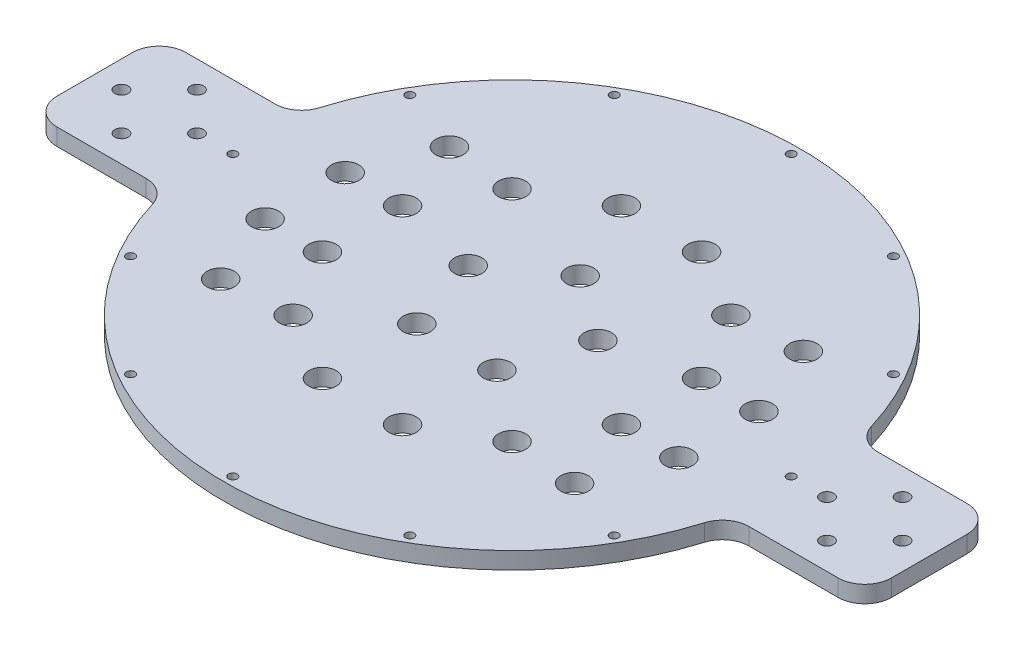
from build123d import *

# Parameters (mm, degrees)
SKETCH1_R              = 107.95
BOSS_EXTRUDE1_DEPTH    = 6.35
M3_CLEARANCE_HOLE1_D   = 3.2
CIRPATTERN1_COUNT      = 12
BOSS_EXTRUDE2_DEPTH    = 6.35
FILLET1_R              = 10
FILLET1_OF_MIRROR1_R   = 10
F_10_CLEARANCE_HOLE3_D = 4.9784
SKETCH11_R             = 5.1
CUT_EXTRUDE1_DEPTH     = 6.35


with BuildPart() as part:
    # Sketch1 → Boss-Extrude1 (new body)
    with BuildSketch(Plane(origin=(0, 0, 0), x_dir=(1, 0, 0), z_dir=(0, 1, 0))):
        with Locations(Location((0, 0, 0), (0, 0, 270))):
            Circle(SKETCH1_R)
    extrude(amount=BOSS_EXTRUDE1_DEPTH)

    # M3 Clearance Hole1 (through all)
    with Locations(Plane(origin=(0, 6.35, 0), x_dir=(1, 0, 0), z_dir=(0, 1, 0))):
        with Locations((0, 104.55)):
            m3_clearance_hole1 = Hole(M3_CLEARANCE_HOLE1_D / 2)

    # CirPattern1: M3 Clearance Hole1 ×12 about axis
    cirpattern1_axis = Axis((0, 0, 0), (0, 1, 0))
    for i in range(1, CIRPATTERN1_COUNT):
        add(m3_clearance_hole1.rotate(cirpattern1_axis, i * 360 / CIRPATTERN1_COUNT), mode=Mode.SUBTRACT)

    # Sketch2 → Boss-Extrude2 (add)
    with BuildSketch(Plane(origin=(0, 0, 0), x_dir=(1, 0, 0), z_dir=(0, 1, 0))):
        with BuildLine():
            Line((-156.234271247, 24.142135624), (-105.215777275, 24.142135624))
            ThreePointArc((-105.215777275, 24.142135624), (-107.95, 0), (-105.215777275, -24.142135624))
            Line((-105.215777275, -24.142135624), (-156.234271247, -24.142135624))
            Line((-156.234271247, -24.142135624), (-156.234271247, 24.142135624))
        make_face()
    boss_extrude2 = extrude(amount=BOSS_EXTRUDE2_DEPTH)

    # Fillet1
    fillet1_edges = [part.edges().sort_by_distance(p)[0] for p in [
        (-156.234271247, 3.175, -24.142135624),
        (-156.234271247, 3.175, 24.142135624),
        (-105.215777275, 3.175, 24.142135624),
        (-105.215777275, 3.175, -24.142135624),
    ]]
    fillet(fillet1_edges, radius=FILLET1_R)

    # Mirror1: Boss-Extrude2 across plane
    add(boss_extrude2.mirror(Plane(origin=(0, 0, 0), x_dir=(0, 0, 1), z_dir=(1, 0, 0))))

    # Fillet1 of Mirror1
    fillet1_of_mirror1_edges = [part.edges().sort_by_distance(p)[0] for p in [
        (156.234271247, 3.175, -24.142135624),
        (156.234271247, 3.175, 24.142135624),
        (105.215777275, 3.175, 24.142135624),
        (105.215777275, 3.175, -24.142135624),
    ]]
    fillet(fillet1_of_mirror1_edges, radius=FILLET1_OF_MIRROR1_R)

    # #10 Clearance Hole3 (through all)
    with Locations(Plane(origin=(0, 6.35, 0), x_dir=(1, 0, 0), z_dir=(0, 1, 0))):
        with Locations((-132.092135624, -14.142135624), (-117.95, 0), (-132.092135624, 14.142135624), (-146.234271247, 0), (146.234271247, 0), (132.092135624, 14.142135624), (117.95, 0), (132.092135624, -14.142135624)):
            Hole(F_10_CLEARANCE_HOLE3_D / 2)

    # Sketch11 → Cut-Extrude1 (cut)
    with BuildSketch(Plane(origin=(0, 6.35, 0), x_dir=(1, 0, 0), z_dir=(0, 1, 0))):
        with Locations(Location((-66.262216278, 42.831398459, 0), (0, 0, 270))):
            Circle(SKETCH11_R)
        with Locations(Location((-77.461022456, 15, 0), (0, 0, 270))):
            Circle(SKETCH11_R)
        with Locations(Location((-77.461022456, -15, 0), (0, 0, 270))):
            Circle(SKETCH11_R)
        with Locations(Location((-66.262216278, -42.831398459, 0), (0, 0, 270))):
            Circle(SKETCH11_R)
        with Locations(Location((0, 25.519524251, 0), (0, 0, 270))):
            Circle(SKETCH11_R)
        with Locations(Location((-24.270509831, 7.885966682, 0), (0, 0, 270))):
            Circle(SKETCH11_R)
        with Locations(Location((24.270509831, 7.885966682, 0), (0, 0, 270))):
            Circle(SKETCH11_R)
        with Locations(Location((-15, -20.645728807, 0), (0, 0, 270))):
            Circle(SKETCH11_R)
        with Locations(Location((15, -20.645728807, 0), (0, 0, 270))):
            Circle(SKETCH11_R)
        with Locations(Location((-55.980762114, -15, 0), (0, 0, 270))):
            Circle(SKETCH11_R)
        with Locations(Location((-40.980762114, -40.980762114, 0), (0, 0, 270))):
            Circle(SKETCH11_R)
        with Locations(Location((-15, -55.980762114, 0), (0, 0, 270))):
            Circle(SKETCH11_R)
        with Locations(Location((15, -55.980762114, 0), (0, 0, 270))):
            Circle(SKETCH11_R)
        with Locations(Location((-55.980762114, 15, 0), (0, 0, 270))):
            Circle(SKETCH11_R)
        with Locations(Location((55.980762114, -15, 0), (0, 0, 270))):
            Circle(SKETCH11_R)
        with Locations(Location((40.980762114, -40.980762114, 0), (0, 0, 270))):
            Circle(SKETCH11_R)
        with Locations(Location((66.262216278, -42.831398459, 0), (0, 0, 270))):
            Circle(SKETCH11_R)
        with Locations(Location((77.461022456, -15, 0), (0, 0, 270))):
            Circle(SKETCH11_R)
        with Locations(Location((77.461022456, 15, 0), (0, 0, 270))):
            Circle(SKETCH11_R)
        with Locations(Location((66.262216278, 42.831398459, 0), (0, 0, 270))):
            Circle(SKETCH11_R)
        with Locations(Location((55.980762114, 15, 0), (0, 0, 270))):
            Circle(SKETCH11_R)
        with Locations(Location((40.980762114, 40.980762114, 0), (0, 0, 270))):
            Circle(SKETCH11_R)
        with Locations(Location((15, 55.980762114, 0), (0, 0, 270))):
            Circle(SKETCH11_R)
        with Locations(Location((-15, 55.980762114, 0), (0, 0, 270))):
            Circle(SKETCH11_R)
        with Locations(Location((-40.980762114, 40.980762114, 0), (0, 0, 270))):
            Circle(SKETCH11_R)
    extrude(amount=-CUT_EXTRUDE1_DEPTH, mode=Mode.SUBTRACT)


solid = part.part
